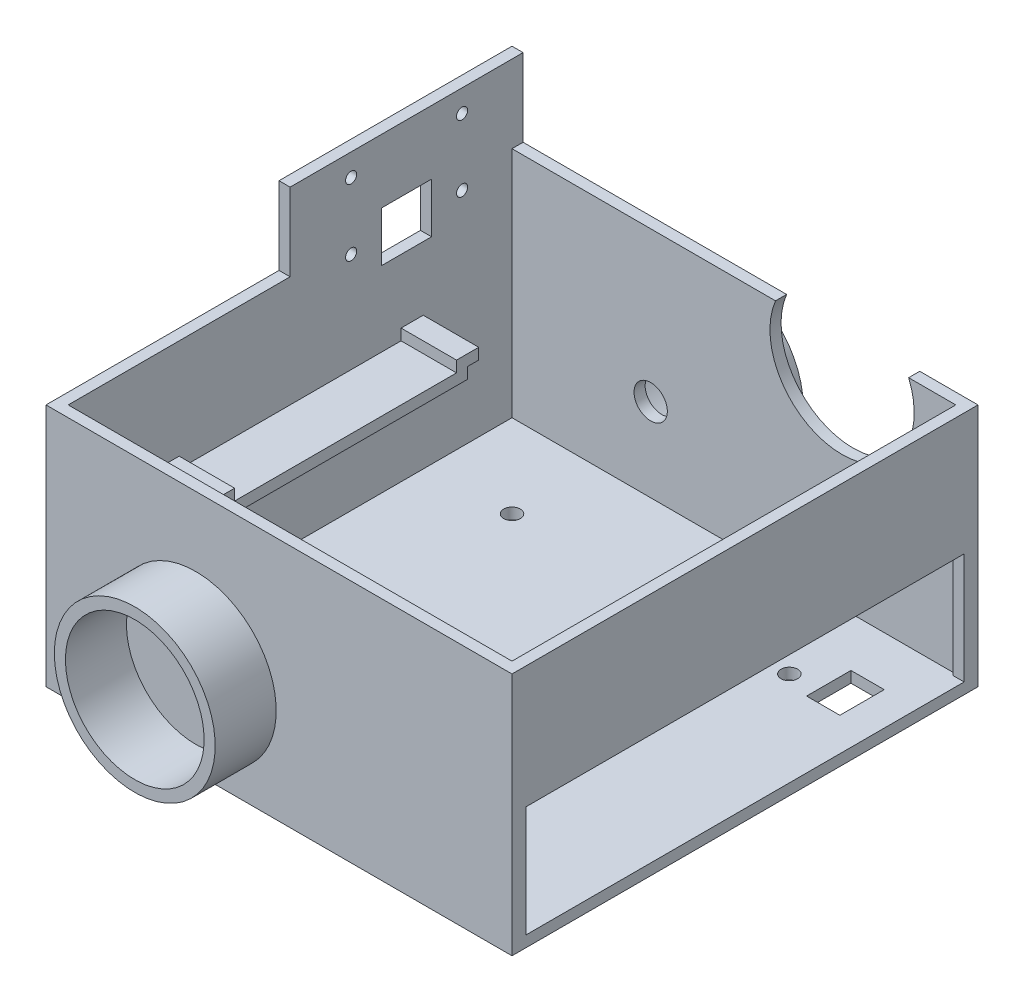
from build123d import *

# Parameters (mm, degrees)
SKETCH1_W           = 84
SKETCH1_H           = 84
BOSS_EXTRUDE1_DEPTH = 22
SKETCH2_W           = 80
SKETCH2_H           = 80
CUT_EXTRUDE1_DEPTH  = 42
SKETCH3_W           = 6
SKETCH3_H           = 8
CUT_EXTRUDE2_DEPTH  = 73.746133918
CUT_EXTRUDE3_REACH  = 98.457
SKETCH5_W           = 79
SKETCH5_H           = 20
BOSS_EXTRUDE2_DEPTH = 10
CUT_EXTRUDE4_REACH  = 98.457
SKETCH6_R           = 13
SKETCH8_W           = 2
SKETCH8_H           = 42
BOSS_EXTRUDE3_DEPTH = 14
CUT_EXTRUDE6_REACH  = 100.914
SKETCH7_R           = 1
SKETCH7_W           = 9
SKETCH7_H           = 9
SKETCH9_R           = 1.5
CUT_EXTRUDE7_DEPTH  = 82.633326528
SKETCH14_R          = 14.5
BOSS_EXTRUDE4_DEPTH = 13
SKETCH15_R          = 12.5
CUT_EXTRUDE8_DEPTH  = 11
CUT_EXTRUDE9_REACH  = 102.578
SKETCH16_R          = 3


with BuildPart() as part:
    # Sketch1 → Boss-Extrude1 (new, symmetric)
    with BuildSketch(Plane(origin=(0, 0, 0), x_dir=(1, 0, 0), z_dir=(0, 1, 0))):
        Rectangle(SKETCH1_W, SKETCH1_H)
    extrude(amount=BOSS_EXTRUDE1_DEPTH, both=True)

    # Sketch2 → Cut-Extrude1 (cut)
    with BuildSketch(Plane(origin=(0, 22, 0), x_dir=(1, 0, 0), z_dir=(0, 1, 0))):
        Rectangle(SKETCH2_W, SKETCH2_H)
    extrude(amount=-CUT_EXTRUDE1_DEPTH, mode=Mode.SUBTRACT)

    # Sketch3 → Cut-Extrude2 (cut, through all)
    with BuildSketch(Plane(origin=(0, -20, 0), x_dir=(1, 0, 0), z_dir=(0, 1, 0))):
        with Locations((33, 27.1)):
            Rectangle(SKETCH3_W, SKETCH3_H)
    extrude(amount=-CUT_EXTRUDE2_DEPTH, mode=Mode.SUBTRACT)

    # Sketch5 → Cut-Extrude3 (cut, up to next)
    with BuildSketch(Plane(origin=(42, 0, 0), x_dir=(0, 0, -1), z_dir=(1, 0, 0)), mode=Mode.PRIVATE) as cut_extrude3_sk1:
        with Locations((0, -10)):
            Rectangle(SKETCH5_W, SKETCH5_H)
    cut_extrude3_tool1 = extrude(cut_extrude3_sk1.sketch, amount=-CUT_EXTRUDE3_REACH, mode=Mode.PRIVATE) & part.part
    add(cut_extrude3_tool1.solids().sort_by_distance((42, -10, 0))[0], mode=Mode.SUBTRACT)

    # Sketch4 → Boss-Extrude2 (add)
    with BuildSketch(Plane(origin=(-40, 0, 0), x_dir=(0, 0, -1), z_dir=(1, 0, 0))):
        Polygon((-22, 4), (-20, 4), (-20, 2), (20, 2), (20, 4), (22, 4), (24, 4), (24, 2), (22, 2), (22, 0), (-22, 0), align=None)
    boss_extrude2 = extrude(amount=BOSS_EXTRUDE2_DEPTH)

    # Mirror1: Boss-Extrude2 across plane
    add(boss_extrude2.mirror(Plane(origin=(0, 0, 0), x_dir=(0, 0, 1), z_dir=(1, 0, 0))))

    # Sketch6 → Cut-Extrude4 (cut, up to next)
    with BuildSketch(Plane(origin=(0, 0, -42), x_dir=(-1, 0, 0), z_dir=(0, 0, -1)), mode=Mode.PRIVATE) as cut_extrude4_sk1:
        with Locations((-19.5, 17)):
            Circle(SKETCH6_R)
    cut_extrude4_tool1 = extrude(cut_extrude4_sk1.sketch, amount=-CUT_EXTRUDE4_REACH, mode=Mode.PRIVATE) & part.part
    add(cut_extrude4_tool1.solids().sort_by_distance((19.5, 17, -42))[0], mode=Mode.SUBTRACT)

    # Sketch8 → Boss-Extrude3 (add)
    with BuildSketch(Plane(origin=(0, 22, 0), x_dir=(1, 0, 0), z_dir=(0, 1, 0))):
        with Locations((-41, 21)):
            Rectangle(SKETCH8_W, SKETCH8_H)
    extrude(amount=BOSS_EXTRUDE3_DEPTH)

    # Sketch7 → Cut-Extrude6 (cut, up to next)
    with BuildSketch(Plane(origin=(-40, 0, 0), x_dir=(0, 0, -1), z_dir=(1, 0, 0)), mode=Mode.PRIVATE) as cut_extrude6_sk1:
        with Locations((31, 32)):
            Circle(SKETCH7_R)
    cut_extrude6_tool1 = extrude(cut_extrude6_sk1.sketch, amount=-CUT_EXTRUDE6_REACH, mode=Mode.PRIVATE) & part.part
    # Sketch7 → Cut-Extrude6 (cut, up to next)
    with BuildSketch(Plane(origin=(-40, 0, 0), x_dir=(0, 0, -1), z_dir=(1, 0, 0)), mode=Mode.PRIVATE) as cut_extrude6_sk2:
        with Locations((31, 20)):
            Circle(SKETCH7_R)
    cut_extrude6_tool2 = extrude(cut_extrude6_sk2.sketch, amount=-CUT_EXTRUDE6_REACH, mode=Mode.PRIVATE) & part.part
    # Sketch7 → Cut-Extrude6 (cut, up to next)
    with BuildSketch(Plane(origin=(-40, 0, 0), x_dir=(0, 0, -1), z_dir=(1, 0, 0)), mode=Mode.PRIVATE) as cut_extrude6_sk3:
        with Locations((11, 20)):
            Circle(SKETCH7_R)
    cut_extrude6_tool3 = extrude(cut_extrude6_sk3.sketch, amount=-CUT_EXTRUDE6_REACH, mode=Mode.PRIVATE) & part.part
    # Sketch7 → Cut-Extrude6 (cut, up to next)
    with BuildSketch(Plane(origin=(-40, 0, 0), x_dir=(0, 0, -1), z_dir=(1, 0, 0)), mode=Mode.PRIVATE) as cut_extrude6_sk4:
        with Locations((11, 32)):
            Circle(SKETCH7_R)
    cut_extrude6_tool4 = extrude(cut_extrude6_sk4.sketch, amount=-CUT_EXTRUDE6_REACH, mode=Mode.PRIVATE) & part.part
    # Sketch7 → Cut-Extrude6 (cut, up to next)
    with BuildSketch(Plane(origin=(-40, 0, 0), x_dir=(0, 0, -1), z_dir=(1, 0, 0)), mode=Mode.PRIVATE) as cut_extrude6_sk5:
        with Locations((21, 20)):
            Rectangle(SKETCH7_W, SKETCH7_H)
    cut_extrude6_tool5 = extrude(cut_extrude6_sk5.sketch, amount=-CUT_EXTRUDE6_REACH, mode=Mode.PRIVATE) & part.part
    add(cut_extrude6_tool1.solids().sort_by_distance((-40, 32, -31))[0], mode=Mode.SUBTRACT)
    add(cut_extrude6_tool2.solids().sort_by_distance((-40, 20, -31))[0], mode=Mode.SUBTRACT)
    add(cut_extrude6_tool3.solids().sort_by_distance((-40, 20, -11))[0], mode=Mode.SUBTRACT)
    add(cut_extrude6_tool4.solids().sort_by_distance((-40, 32, -11))[0], mode=Mode.SUBTRACT)
    add(cut_extrude6_tool5.solids().sort_by_distance((-40, 20, -21))[0], mode=Mode.SUBTRACT)

    # Sketch9 → Cut-Extrude7 (cut, through all)
    with BuildSketch(Plane(origin=(0, -20, 0), x_dir=(1, 0, 0), z_dir=(0, 1, 0))):
        with Locations(Location((-25, 25, 0), (0, 0, 270))):
            Circle(SKETCH9_R)
        with Locations(Location((25, 25, 0), (0, 0, 270))):
            Circle(SKETCH9_R)
        with Locations(Location((25, -25, 0), (0, 0, 270))):
            Circle(SKETCH9_R)
        with Locations(Location((-25, -25, 0), (0, 0, 270))):
            Circle(SKETCH9_R)
    extrude(amount=-CUT_EXTRUDE7_DEPTH, mode=Mode.SUBTRACT)

    # Sketch14 → Boss-Extrude4 (add)
    with BuildSketch(Plane.XY.offset(-40)):
        with Locations((-15, -5)):
            Circle(SKETCH14_R)
    boss_extrude4 = extrude(amount=-BOSS_EXTRUDE4_DEPTH)

    # Sketch15 → Cut-Extrude8 (cut)
    with BuildSketch(Plane(origin=(0, 0, -53), x_dir=(-1, 0, 0), z_dir=(0, 0, -1))):
        with Locations((15, -5)):
            Circle(SKETCH15_R)
    cut_extrude8 = extrude(amount=-CUT_EXTRUDE8_DEPTH, mode=Mode.SUBTRACT)

    # Sketch16 → Cut-Extrude9 (cut, up to next)
    with BuildSketch(Plane(origin=(0, 0, -42), x_dir=(-1, 0, 0), z_dir=(0, 0, -1)), mode=Mode.PRIVATE) as cut_extrude9_sk1:
        with Locations((15, -5)):
            Circle(SKETCH16_R)
    cut_extrude9_tool1 = extrude(cut_extrude9_sk1.sketch, amount=-CUT_EXTRUDE9_REACH, mode=Mode.PRIVATE) & part.part
    cut_extrude9 = cut_extrude9_tool1.solids().sort_by_distance((-15, -5, -42))[0]
    add(cut_extrude9, mode=Mode.SUBTRACT)

    # Mirror2: Boss-Extrude4, Cut-Extrude8, Cut-Extrude9 across plane
    add(boss_extrude4.mirror(Plane.XY))
    add(cut_extrude8.mirror(Plane.XY), mode=Mode.SUBTRACT)
    add(cut_extrude9.mirror(Plane.XY), mode=Mode.SUBTRACT)


solid = part.part
